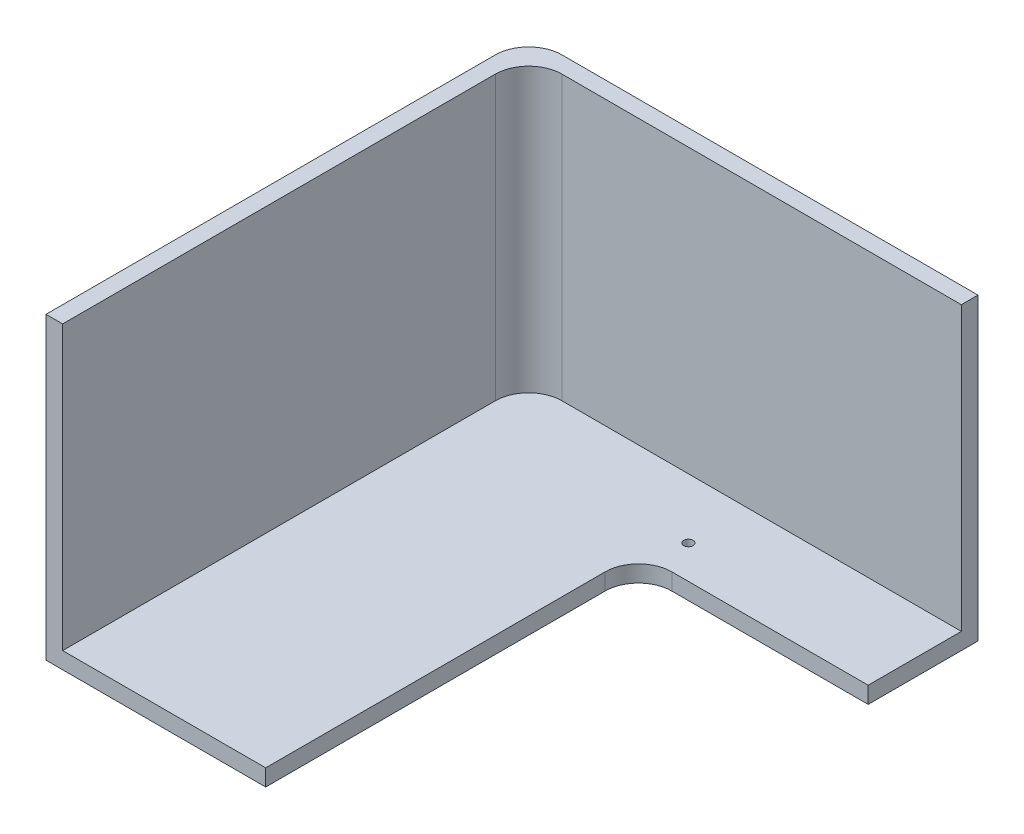
from build123d import *

# Parameters (mm, degrees)
SKETCH_1_W          = 135
SKETCH_1_H          = 145
EXTRUDE_1_DEPTH     = 90
SKETCH_2_W          = 130
SKETCH_2_H          = 140
CUT_EXTRUDE_1_DEPTH = 85
SKETCH_3_W          = 69
SKETCH_3_H          = 112
CUT_EXTRUDE_2_DEPTH = 5
SKETCH_4_R          = 1.4
CUT_EXTRUDE_3_DEPTH = 5
FILLET_1_R          = 10


with BuildPart() as part:
    # 草图1 → 凸台-拉伸1 (new body)
    with BuildSketch(Plane(origin=(0, 0, 0), x_dir=(1, 0, 0), z_dir=(0, 1, 0))):
        with Locations((-67.5, -72.5)):
            Rectangle(SKETCH_1_W, SKETCH_1_H)
    extrude(amount=EXTRUDE_1_DEPTH)

    # 草图2 → 切除-拉伸1 (cut)
    with BuildSketch(Plane(origin=(0, 90, 0), x_dir=(1, 0, 0), z_dir=(0, 1, 0))):
        with Locations((-65, -75)):
            Rectangle(SKETCH_2_W, SKETCH_2_H)
    extrude(amount=-CUT_EXTRUDE_1_DEPTH, mode=Mode.SUBTRACT)

    # 草图3 → 切除-拉伸2 (cut)
    with BuildSketch(Plane(origin=(0, 5, 0), x_dir=(1, 0, 0), z_dir=(0, 1, 0))):
        with Locations((-34.5, -89)):
            Rectangle(SKETCH_3_W, SKETCH_3_H)
    extrude(amount=-CUT_EXTRUDE_2_DEPTH, mode=Mode.SUBTRACT)

    # 草图4 → 切除-拉伸3 (cut)
    with BuildSketch(Plane(origin=(0, 5, 0), x_dir=(1, 0, 0), z_dir=(0, 1, 0))):
        with Locations(Location((-64, -23, 0), (0, 0, 270))):
            Circle(SKETCH_4_R)
    extrude(amount=-CUT_EXTRUDE_3_DEPTH, mode=Mode.SUBTRACT)

    # 圆角1
    fillet_1_edges = [part.edges().sort_by_distance(p)[0] for p in [
        (-130, 47.5, 5),
        (-69, 2.5, 33),
        (-135, 45, 0),
    ]]
    fillet(fillet_1_edges, radius=FILLET_1_R)


solid = part.part
